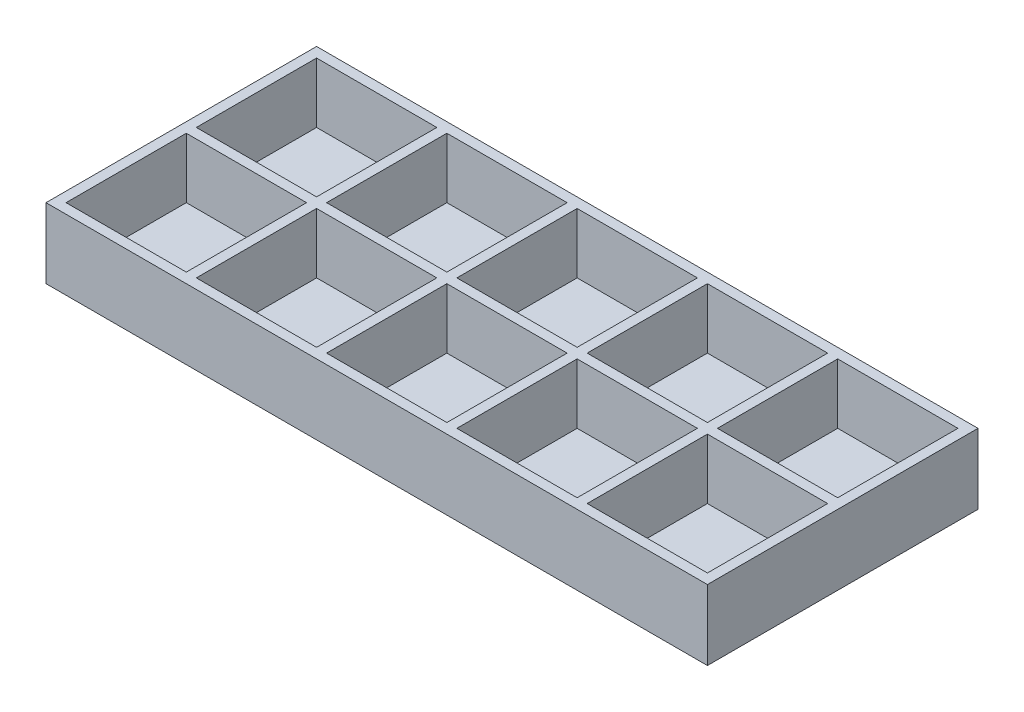
from build123d import *

# Parameters (mm, degrees)
CROQUIS1_W              = 330
CROQUIS1_H              = 135
SALIENTE_EXTRUIR1_DEPTH = 5
CROQUIS2_W              = 330
CROQUIS2_H              = 135
CROQUIS2_W_2            = 60
CROQUIS2_H_2            = 60
SALIENTE_EXTRUIR2_DEPTH = 30


with BuildPart() as part:
    # Croquis1 → Saliente-Extruir1 (new body)
    with BuildSketch(Plane(origin=(0, 0, 0), x_dir=(1, 0, 0), z_dir=(0, 1, 0))):
        Rectangle(CROQUIS1_W, CROQUIS1_H)
    extrude(amount=SALIENTE_EXTRUIR1_DEPTH)

    # Croquis2 → Saliente-Extruir2 (add)
    with BuildSketch(Plane(origin=(0, 5, 0), x_dir=(1, 0, 0), z_dir=(0, 1, 0))):
        Rectangle(CROQUIS2_W, CROQUIS2_H)
        with Locations((-130, 32.5)):
            Rectangle(CROQUIS2_W_2, CROQUIS2_H_2, mode=Mode.SUBTRACT)
        with Locations((-65, 32.5)):
            Rectangle(CROQUIS2_W_2, CROQUIS2_H_2, mode=Mode.SUBTRACT)
        with Locations((0, 32.5)):
            Rectangle(CROQUIS2_W_2, CROQUIS2_H_2, mode=Mode.SUBTRACT)
        with Locations((65, 32.5)):
            Rectangle(CROQUIS2_W_2, CROQUIS2_H_2, mode=Mode.SUBTRACT)
        with Locations((130, 32.5)):
            Rectangle(CROQUIS2_W_2, CROQUIS2_H_2, mode=Mode.SUBTRACT)
        with Locations((-130, -32.5)):
            Rectangle(CROQUIS2_W_2, CROQUIS2_H_2, mode=Mode.SUBTRACT)
        with Locations((-65, -32.5)):
            Rectangle(CROQUIS2_W_2, CROQUIS2_H_2, mode=Mode.SUBTRACT)
        with Locations((0, -32.5)):
            Rectangle(CROQUIS2_W_2, CROQUIS2_H_2, mode=Mode.SUBTRACT)
        with Locations((65, -32.5)):
            Rectangle(CROQUIS2_W_2, CROQUIS2_H_2, mode=Mode.SUBTRACT)
        with Locations((130, -32.5)):
            Rectangle(CROQUIS2_W_2, CROQUIS2_H_2, mode=Mode.SUBTRACT)
    extrude(amount=SALIENTE_EXTRUIR2_DEPTH)


solid = part.part
